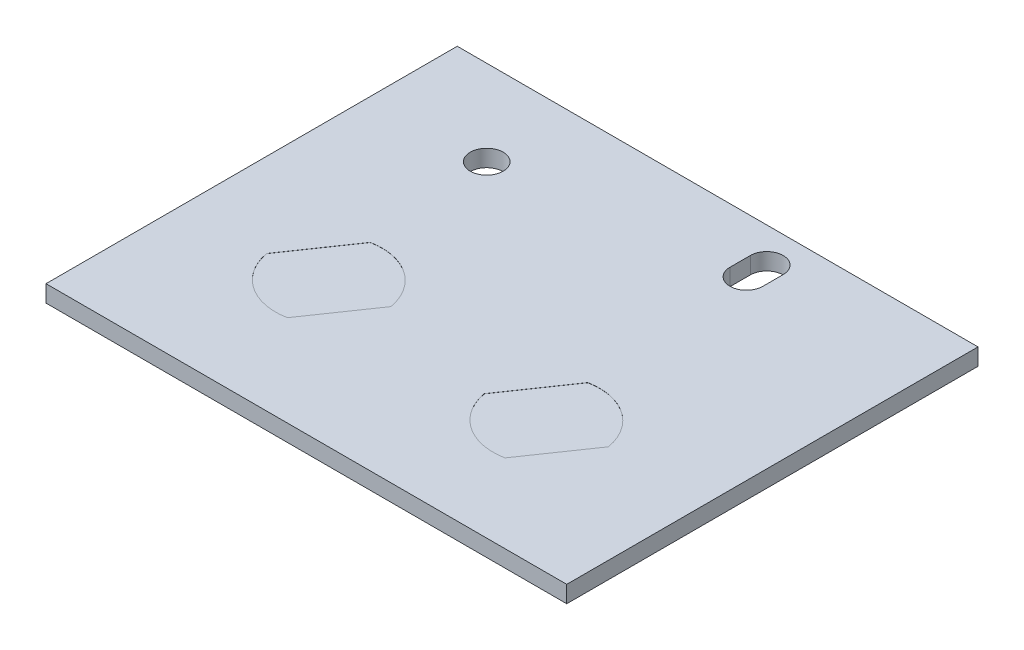
from build123d import *

# Parameters (mm, degrees)
ESQUISSE1_W             = 37.1
ESQUISSE1_H             = 29.3
ESQUISSE1_R             = 1.175
BOSS_EXTRU_1_DEPTH      = 1.2
ENL_V_MAT_EXTRU_1_DEPTH = 0.01


with BuildPart() as part:
    # Esquisse1 → Boss.-Extru.1 (new body)
    with BuildSketch(Plane(origin=(0, 0, 0), x_dir=(1, 0, 0), z_dir=(0, 1, 0))):
        Rectangle(ESQUISSE1_W, ESQUISSE1_H)
        with Locations(Location((-10.375, 8.575, 0), (0, 0, 270))):
            Circle(ESQUISSE1_R, mode=Mode.SUBTRACT)
        with BuildLine():
            Line((7.15, 12.175), (7.15, 10.725))
            ThreePointArc((7.15, 10.725), (5.975, 9.55), (4.8, 10.725))
            Line((4.8, 10.725), (4.8, 12.175))
            ThreePointArc((4.8, 12.175), (5.975, 13.35), (7.15, 12.175))
        make_face(mode=Mode.SUBTRACT)
    extrude(amount=BOSS_EXTRU_1_DEPTH)

    # Esquisse2 → Enlèv. mat.-Extru.1 (cut)
    with BuildSketch(Plane(origin=(0, 1.2, 0), x_dir=(1, 0, 0), z_dir=(0, 1, 0))):
        with BuildLine():
            Line((-12.55, -4.923584906), (-9.55, -0.554374451))
            ThreePointArc((-9.55, -0.554374451), (-6.521273623, -1.1783268), (-4.851037813, -3.780789545))
            Line((-4.851037813, -3.780789545), (-7.851037813, -8.15))
            ThreePointArc((-7.851037813, -8.15), (-10.879764189, -7.52604765), (-12.55, -4.923584906))
        make_face()
        with BuildLine():
            Line((3.851037813, -5.824109363), (6.851037813, -1.454898908))
            ThreePointArc((6.851037813, -1.454898908), (9.879764189, -2.078851257), (11.55, -4.681314002))
            Line((11.55, -4.681314002), (8.55, -9.050524457))
            ThreePointArc((8.55, -9.050524457), (5.521273623, -8.426572107), (3.851037813, -5.824109363))
        make_face()
    extrude(amount=-ENL_V_MAT_EXTRU_1_DEPTH, mode=Mode.SUBTRACT)


solid = part.part
